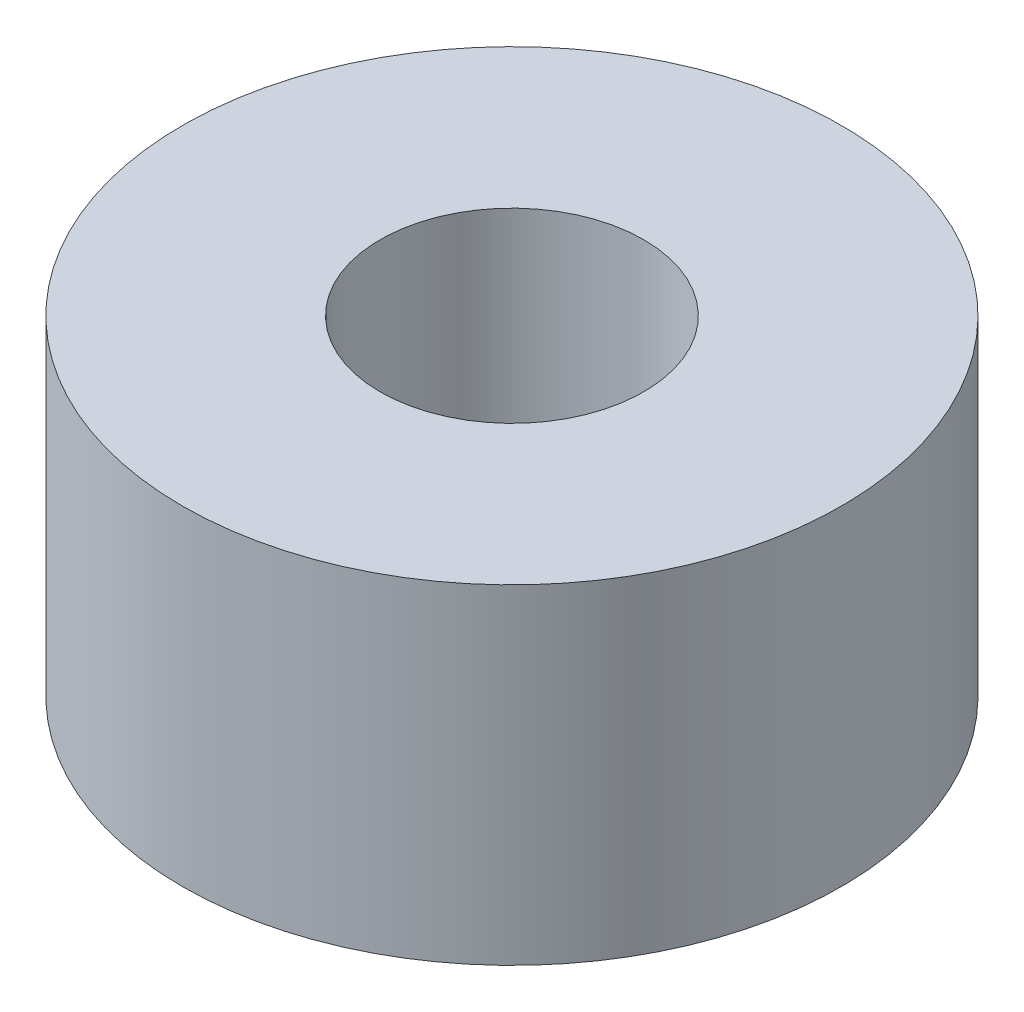
from build123d import *

# Parameters (mm, degrees)
ESQUISSE3_R        = 10
ESQUISSE3_R_2      = 4
BOSS_EXTRU_2_DEPTH = 10


with BuildPart() as part:
    # Esquisse3 → Boss.-Extru.2 (new body)
    with BuildSketch(Plane(origin=(0, 0, 0), x_dir=(1, 0, 0), z_dir=(0, 1, 0))):
        with Locations(Location((0, 0, 0), (0, 0, 270))):
            Circle(ESQUISSE3_R)
        with Locations(Location((0, 0, 0), (0, 0, 270))):
            Circle(ESQUISSE3_R_2, mode=Mode.SUBTRACT)
    extrude(amount=BOSS_EXTRU_2_DEPTH)


solid = part.part
